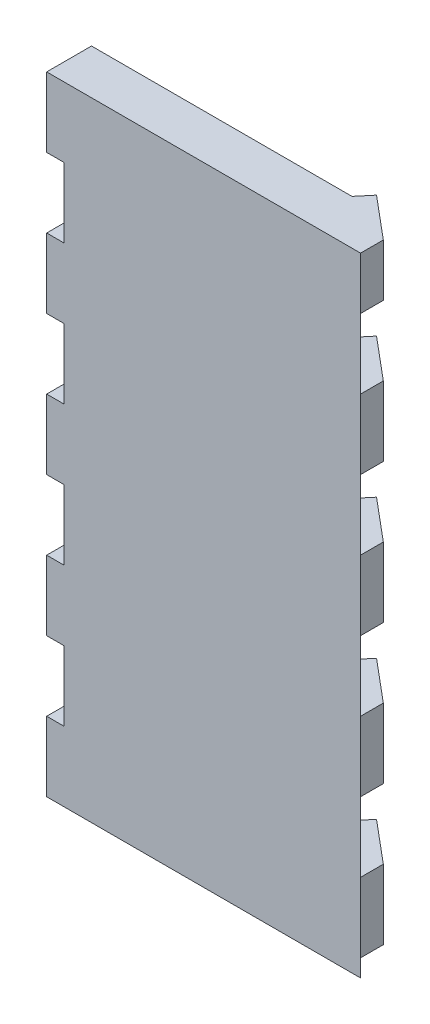
from build123d import *

# Parameters (mm, degrees)
BOSS_EXTRUDE1_DEPTH = 228.6
SKETCH2_W           = 25.4
SKETCH2_H           = 25.4
SKETCH2_H_2         = 19.05
BOSS_EXTRUDE2_DEPTH = 6.35
SKETCH3_W           = 25.4
SKETCH3_H           = 25.4
CUT_EXTRUDE1_DEPTH  = 228.6
SKETCH4_W           = 16.326805286
SKETCH4_H           = 25.4
BOSS_EXTRUDE3_DEPTH = 6.35


with BuildPart() as part:
    # Sketch1 → Boss-Extrude1 (new body)
    with BuildSketch(Plane(origin=(0, 0, 0), x_dir=(1, 0, 0), z_dir=(0, 1, 0))):
        Polygon((-53.975, 0), (53.975, 0), (34.517471145, 16.326805286), (-53.975, 16.326805286), align=None)
    extrude(amount=BOSS_EXTRUDE1_DEPTH)

    # Sketch2 → Boss-Extrude2 (add)
    with BuildSketch(Plane(origin=(22.301169805, 0, -26.577499234), x_dir=(-0.7660444431189816, 0, -0.6427876096865351), z_dir=(0.6427876096865351, 0, -0.7660444431189816))):
        with Locations((-28.647248817, 19.05)):
            Rectangle(SKETCH2_W, SKETCH2_H)
        with Locations((-28.647248817, 69.85)):
            Rectangle(SKETCH2_W, SKETCH2_H)
        with Locations((-28.647248817, 120.65)):
            Rectangle(SKETCH2_W, SKETCH2_H)
        with Locations((-28.647248817, 171.45)):
            Rectangle(SKETCH2_W, SKETCH2_H)
        with Locations((-28.647248817, 219.075)):
            Rectangle(SKETCH2_W, SKETCH2_H_2)
    extrude(amount=BOSS_EXTRUDE2_DEPTH)

    # Sketch3 → Cut-Extrude1 (cut)
    with BuildSketch(Plane(origin=(0, 228.6, 0), x_dir=(1, 0, 0), z_dir=(0, 1, 0))):
        with Locations((66.675, 12.7)):
            Rectangle(SKETCH3_W, SKETCH3_H)
    extrude(amount=-CUT_EXTRUDE1_DEPTH, mode=Mode.SUBTRACT)

    # Sketch4 → Boss-Extrude3 (add)
    with BuildSketch(Plane.ZY.offset(53.975)):
        with Locations((-8.163402643, 12.7)):
            Rectangle(SKETCH4_W, SKETCH4_H)
        with Locations((-8.163402643, 63.5)):
            Rectangle(SKETCH4_W, SKETCH4_H)
        with Locations((-8.163402643, 114.3)):
            Rectangle(SKETCH4_W, SKETCH4_H)
        with Locations((-8.163402643, 165.1)):
            Rectangle(SKETCH4_W, SKETCH4_H)
        with Locations((-8.163402643, 215.9)):
            Rectangle(SKETCH4_W, SKETCH4_H)
    extrude(amount=BOSS_EXTRUDE3_DEPTH)


solid = part.part
